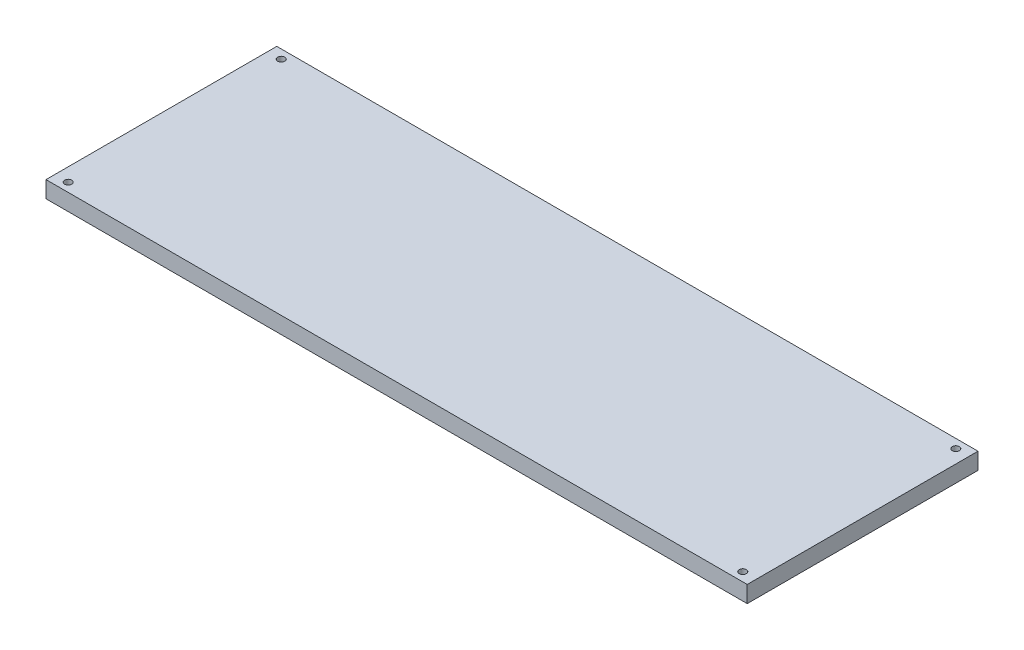
from build123d import *

# Parameters (mm, degrees)
SKETCH1_W                  = 501.65
SKETCH1_H                  = 165.1
BOSS_EXTRUDE1_DEPTH        = 11.90625
F_7_0_201_DIAMETER_HOLE1_D = 5.1054


with BuildPart() as part:
    # Sketch1 → Boss-Extrude1 (new body)
    with BuildSketch(Plane(origin=(0, 0, 0), x_dir=(1, 0, 0), z_dir=(0, 1, 0))):
        Rectangle(SKETCH1_W, SKETCH1_H)
    extrude(amount=BOSS_EXTRUDE1_DEPTH)

    # #7 (0.201) Diameter Hole1 (through all)
    with Locations(Plane(origin=(0, 11.90625, 0), x_dir=(1, 0, 0), z_dir=(0, 1, 0))):
        with Locations((-241.3, 76.2), (241.3, 76.2), (241.3, -76.2), (-241.3, -76.2)):
            Hole(F_7_0_201_DIAMETER_HOLE1_D / 2)


solid = part.part
